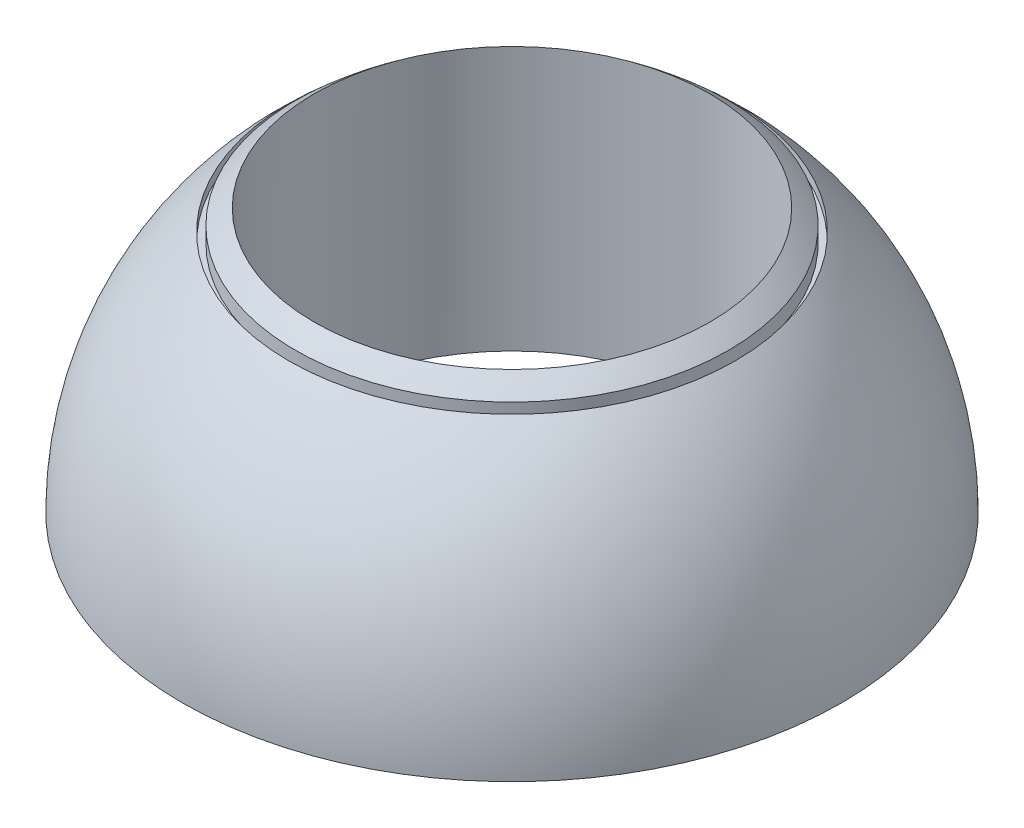
from build123d import *


with BuildPart() as part:
    # Sketch1 → Revolve1 (revolve)
    with BuildSketch(Plane.XY, mode=Mode.PRIVATE) as revolve1_sk:
        with BuildLine():
            Line((3, 0), (3, 4))
            ThreePointArc((3, 4), (4.472135955, 2.236067977), (5, 0))
            Line((5, 0), (3, 0))
        make_face()
    revolve(revolve1_sk.sketch.rotate(Axis((0, 0, 0), (0, 1, 0)), 90), axis=Axis((0, 0, 0), (0, 1, 0)))

    # Sketch2 → Cut-Revolve1 (revolve, cut)
    with BuildSketch(Plane(origin=(0, 0, 0), x_dir=(0, 0, -1), z_dir=(1, 0, 0))):
        Polygon((3.283055217, 3.771146834), (3.283055217, 3.53723963), (3.383055217, 3.53723963), (3.383055217, 3.783827608), (3.383055217, 3.915367926), (3.283055217, 3.915367926), align=None)
    revolve(axis=Axis((0, 0, 0), (0, 1, 0)), mode=Mode.SUBTRACT)


solid = part.part
